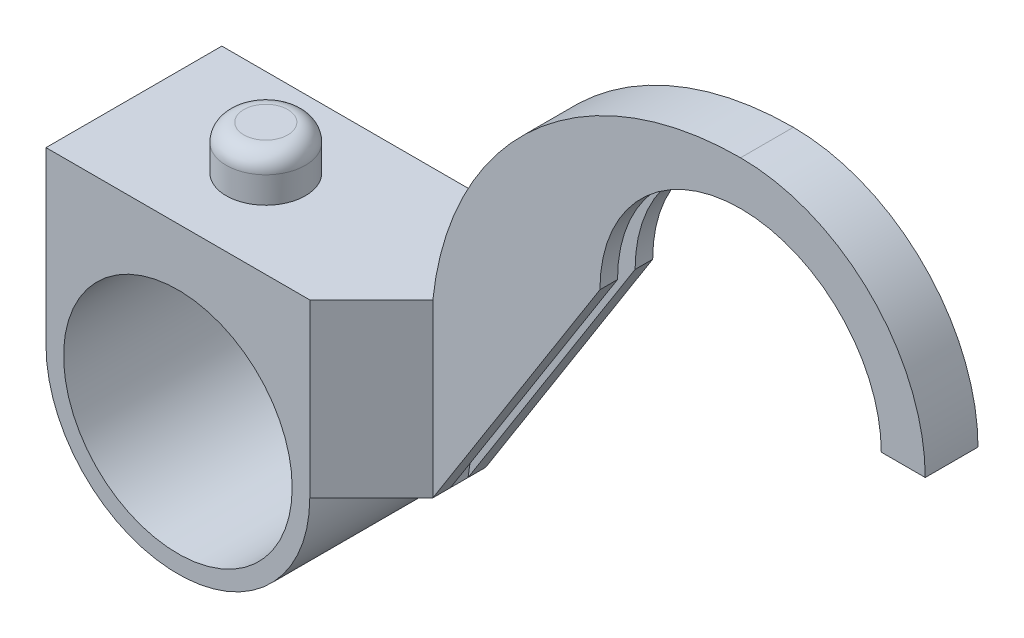
from build123d import *

# Parameters (mm, degrees)
SKETCH1_R           = 13
BOSS_EXTRUDE1_DEPTH = 10
BOSS_EXTRUDE2_DEPTH = 19.5
BOSS_EXTRUDE3_DEPTH = 3
BOSS_EXTRUDE4_DEPTH = 2
SKETCH5_R           = 4.5
BOSS_EXTRUDE5_DEPTH = 5
FILLET1_R           = 2


with BuildPart() as part:
    # Sketch1 → Boss-Extrude1 (new, symmetric)
    with BuildSketch(Plane.XY):
        with BuildLine():
            Line((-15, 0), (-15, 19.5))
            Line((-15, 19.5), (15, 19.5))
            Line((15, 19.5), (15, 0))
            ThreePointArc((15, 0), (0, -15), (-15, 0))
        make_face()
        Circle(SKETCH1_R, mode=Mode.SUBTRACT)
    extrude(amount=BOSS_EXTRUDE1_DEPTH, both=True)

    # Sketch3 → Boss-Extrude2 (add)
    with BuildSketch(Plane(origin=(0, 19.5, 0), x_dir=(1, 0, 0), z_dir=(0, 1, 0))):
        Polygon((15, 10), (22, 3), (22, -3), (15, -10), align=None)
    extrude(amount=-BOSS_EXTRUDE2_DEPTH)

    # Sketch2 → Boss-Extrude3 (add, symmetric)
    with BuildSketch(Plane.XY):
        with BuildLine():
            Line((78, 30), (76, 30))
            ThreePointArc((76, 30), (64.47643512, 47.467195479), (43.88390338, 43.74656355))
            ThreePointArc((43.88390338, 43.74656355), (29.130686528, 23.779839726), (22, 0))
            Line((22, 0), (22, 19.5))
            ThreePointArc((22, 19.5), (33.456157918, 41.965380092), (57, 51))
            ThreePointArc((57, 51), (71.849242405, 44.849242405), (78, 30))
        make_face()
    extrude(amount=BOSS_EXTRUDE3_DEPTH, both=True)


with BuildPart() as body_2:
    # Sketch4 → Boss-Extrude4 (new body)
    with BuildSketch(Plane.XY.offset(3)):
        with BuildLine():
            Line((73, 30), (76, 30))
            ThreePointArc((76, 30), (64.47643512, 47.467195479), (43.88390338, 43.74656355))
            ThreePointArc((43.88390338, 43.74656355), (29.130686528, 23.779839726), (22, 0))
            Line((22, 0), (41, 30))
            ThreePointArc((41, 30), (57, 46), (73, 30))
        make_face()
    extrude(amount=-BOSS_EXTRUDE4_DEPTH)


with BuildPart() as body_3:
    # Mirror1: mirrored copy
    add(body_2.part.mirror(Plane.XY))


with BuildPart() as body_2_1:
    add(body_2.part)

    # Combine2: union body 3, part
    add(body_3.part)
    add(part.part)

    # Sketch5 → Boss-Extrude5 (add, symmetric)
    with BuildSketch(Plane(origin=(0, 19.5, 0), x_dir=(1, 0, 0), z_dir=(0, 1, 0))):
        with Locations(Location((0, 0, 0), (0, 0, 90))):
            Circle(SKETCH5_R)
    extrude(amount=BOSS_EXTRUDE5_DEPTH, both=True)

    # Fillet1
    fillet1_edges = [body_2_1.edges().sort_by_distance(p)[0] for p in [
        (0, 24.5, 4.5),
    ]]
    fillet(fillet1_edges, radius=FILLET1_R)


solid = body_2_1.part
